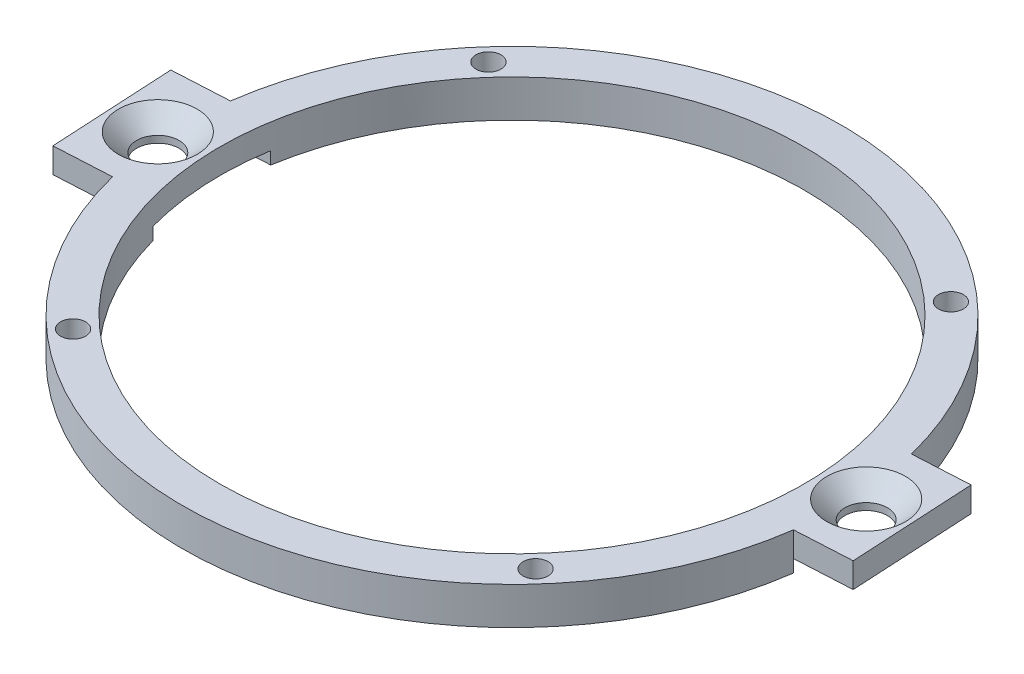
from build123d import *

# Parameters (mm, degrees)
SKETCH1_R                                      = 23.401000001
BOSS_EXTRUDE1_DEPTH                            = 2
SKETCH2_R                                      = 1
CUT_EXTRUDE1_DEPTH                             = 10
BOSS_EXTRUDE3_START                            = 1
SKETCH6_R                                      = 1
BOSS_EXTRUDE3_DEPTH                            = 1
CSK_FOR_M3_FLAT_HEAD_MACHINE_SCREW1_AT_2_COUNT = 2
CSK_FOR_M3_FLAT_HEAD_MACHINE_SCREW1_AT_2_PITCH = 53.936


with BuildPart() as part:
    # Sketch1 → Boss-Extrude1 (new body)
    with BuildSketch(Plane(origin=(0, 0, 0), x_dir=(1, 0, 0), z_dir=(0, 1, 0))):
        with BuildLine():
            Line((-103.941978749, -29.858528223), (-100.420009087, -29.669294121))
            Line((-100.420009087, -29.669294121), (-99.403734393, -29.614690064))
            ThreePointArc((-99.403734393, -29.614690064), (-74.666073862, -6.853676168), (-47.63199035, -26.833013765))
            Line((-47.63199035, -26.833013765), (-46.615715656, -26.778409709))
            Line((-46.615715656, -26.778409709), (-43.093745994, -26.589175606))
            Line((-43.093745994, -26.589175606), (-42.55722364, -36.574772421))
            Line((-42.55722364, -36.574772421), (-46.079193302, -36.764006524))
            Line((-46.079193302, -36.764006524), (-47.095467996, -36.81861058))
            ThreePointArc((-47.095467996, -36.81861058), (-71.833128527, -59.579624476), (-98.867212039, -39.60028688))
            Line((-98.867212039, -39.60028688), (-99.883486733, -39.654890936))
            Line((-99.883486733, -39.654890936), (-103.405456395, -39.844125039))
            Line((-103.405456395, -39.844125039), (-103.941978749, -29.858528223))
        make_face()
        with Locations(Location((-73.249601195, -33.216650322, 0), (0, 0, 270))):
            Circle(SKETCH1_R, mode=Mode.SUBTRACT)
    extrude(amount=BOSS_EXTRUDE1_DEPTH)

    # Sketch2 → Cut-Extrude1 (cut)
    with BuildSketch(Plane(origin=(0, 2, 0), x_dir=(1, 0, 0), z_dir=(0, 1, 0))):
        with Locations(Location((-91.776597147, -16.579035648, 0), (0, 0, 270))):
            Circle(SKETCH2_R)
        with Locations(Location((-56.611986521, -14.68965437, 0), (0, 0, 270))):
            Circle(SKETCH2_R)
        with Locations(Location((-54.722605242, -49.854264996, 0), (0, 0, 270))):
            Circle(SKETCH2_R)
        with Locations(Location((-89.887215869, -51.743646275, 0), (0, 0, 270))):
            Circle(SKETCH2_R)
    extrude(amount=-CUT_EXTRUDE1_DEPTH, mode=Mode.SUBTRACT)

    # Sketch6 → Boss-Extrude3 (add)
    # profile 1 of 2: a face of its own
    with BuildSketch(Plane.XZ.offset(BOSS_EXTRUDE3_START)):
        with BuildLine():
            ThreePointArc((-47.095467996, 36.81861058), (-71.833128527, 59.579624476), (-98.867212039, 39.60028688))
            Line((-98.867212039, 39.60028688), (-95.809008422, 39.435970752))
            ThreePointArc((-95.809008422, 39.435970752), (-71.994085233, 56.583945432), (-50.153671613, 36.982926708))
            Line((-50.153671613, 36.982926708), (-47.095467996, 36.81861058))
        make_face()
        with Locations(Location((-89.887215869, 51.743646275, 0), (0, 0, 90))):
            Circle(SKETCH6_R, mode=Mode.SUBTRACT)
        with Locations(Location((-54.722605242, 49.854264996, 0), (0, 0, 90))):
            Circle(SKETCH6_R, mode=Mode.SUBTRACT)
    # profile 2 of 2: a face of its own
    with BuildSketch(Plane.XZ.offset(BOSS_EXTRUDE3_START)):
        with BuildLine():
            ThreePointArc((-50.690193967, 26.997329893), (-74.505117156, 9.849355213), (-96.345530776, 29.450373936))
            Line((-96.345530776, 29.450373936), (-99.403734393, 29.614690064))
            ThreePointArc((-99.403734393, 29.614690064), (-74.666073862, 6.853676168), (-47.63199035, 26.833013765))
            Line((-47.63199035, 26.833013765), (-50.690193967, 26.997329893))
        make_face()
        with Locations(Location((-91.776597147, 16.579035648, 0), (0, 0, 90))):
            Circle(SKETCH6_R, mode=Mode.SUBTRACT)
        with Locations(Location((-56.611986521, 14.68965437, 0), (0, 0, 90))):
            Circle(SKETCH6_R, mode=Mode.SUBTRACT)
    extrude(amount=-BOSS_EXTRUDE3_DEPTH)

    # Sketch9 → CSK for M3 Flat Head Machine Screw1 (revolve, cut)
    with BuildSketch(Plane(origin=(-100.178758687, 2, 34.663543807), x_dir=(0, 0, 1), z_dir=(1, 0, 0))):
        Polygon((0, 0), (0, 3.000025), (1.7, 3.000025), (1.7, 1.45), (3.15, 0), align=None)
    csk_for_m3_flat_head_machine_screw1 = revolve(axis=Axis((-100.178758687, 8.35, 34.663543807), (0, -1, 0)), mode=Mode.SUBTRACT)

    # CSK for M3 Flat Head Machine Screw1 at 2: CSK for M3 Flat Head Machine Screw1 ×2
    with Locations(*[Vector(0.9985596815585082, 0, -0.05365223542193572) * (i * CSK_FOR_M3_FLAT_HEAD_MACHINE_SCREW1_AT_2_PITCH) for i in range(1, CSK_FOR_M3_FLAT_HEAD_MACHINE_SCREW1_AT_2_COUNT)]):
        add(csk_for_m3_flat_head_machine_screw1, mode=Mode.SUBTRACT)


solid = part.part
